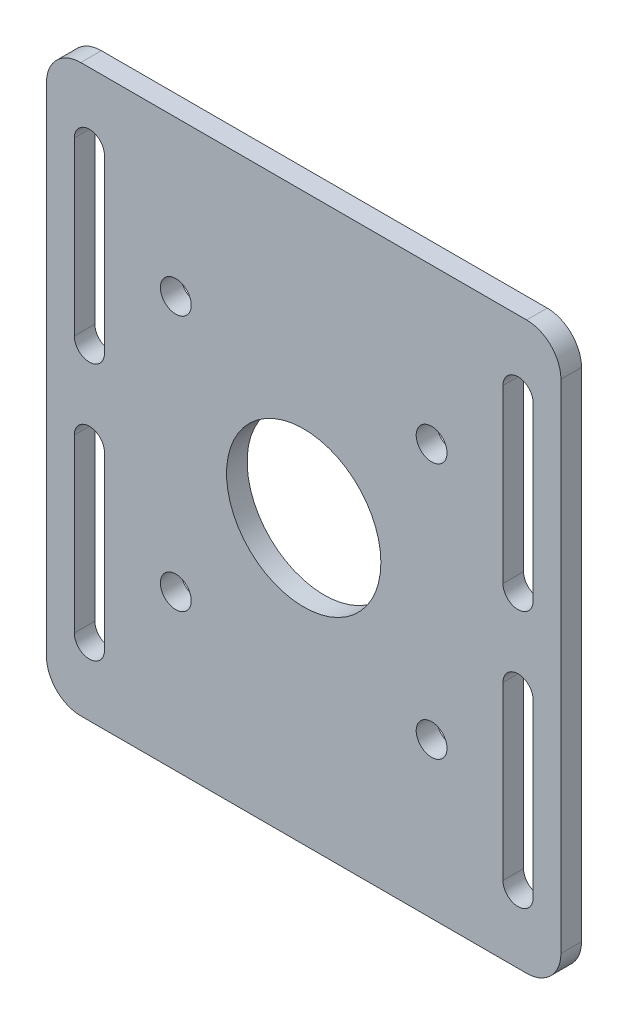
from build123d import *

# Parameters (mm, degrees)
SKETCH_1_W          = 300
SKETCH_1_H          = 330
SKETCH_1_R          = 45
EXTRUDE_1_DEPTH     = 6
CUT_EXTRUDE_1_DEPTH = 224.313680727
FILLET_1_R          = 20
SKETCH_3_R          = 9
CUT_EXTRUDE_2_DEPTH = 12


with BuildPart() as part:
    # Эскиз1 → Бобышка-Вытянуть1 (new, symmetric)
    with BuildSketch(Plane.XY):
        Rectangle(SKETCH_1_W, SKETCH_1_H)
        Circle(SKETCH_1_R, mode=Mode.SUBTRACT)
    extrude(amount=EXTRUDE_1_DEPTH, both=True)

    # Эскиз2 → Вырез-Вытянуть1 (cut, through all)
    with BuildSketch(Plane.XY.offset(6)):
        with BuildLine():
            Line((-116.2, 125), (-116.2, 25))
            ThreePointArc((-116.2, 25), (-125, 16.2), (-133.8, 25))
            Line((-133.8, 25), (-133.8, 125))
            ThreePointArc((-133.8, 125), (-125, 133.8), (-116.2, 125))
        make_face()
        with BuildLine():
            Line((-116.2, -125), (-116.2, -25))
            ThreePointArc((-116.2, -25), (-125, -16.2), (-133.8, -25))
            Line((-133.8, -25), (-133.8, -125))
            ThreePointArc((-133.8, -125), (-125, -133.8), (-116.2, -125))
        make_face()
        with BuildLine():
            Line((116.2, -125), (116.2, -25))
            ThreePointArc((116.2, -25), (125, -16.2), (133.8, -25))
            Line((133.8, -25), (133.8, -125))
            ThreePointArc((133.8, -125), (125, -133.8), (116.2, -125))
        make_face()
        with BuildLine():
            Line((116.2, 125), (116.2, 25))
            ThreePointArc((116.2, 25), (125, 16.2), (133.8, 25))
            Line((133.8, 25), (133.8, 125))
            ThreePointArc((133.8, 125), (125, 133.8), (116.2, 125))
        make_face()
    extrude(amount=-CUT_EXTRUDE_1_DEPTH, mode=Mode.SUBTRACT)

    # Скругление1
    fillet_1_edges = [part.edges().sort_by_distance(p)[0] for p in [
        (150, -165, 0),
        (-150, -165, 0),
        (-150, 165, 0),
        (150, 165, 0),
    ]]
    fillet(fillet_1_edges, radius=FILLET_1_R)

    # Эскиз3 → Вырез-Вытянуть2 (cut)
    with BuildSketch(Plane.XY.offset(6)):
        with Locations((-74.599765415, 74.599765415)):
            Circle(SKETCH_3_R)
        with Locations((74.599765415, 74.599765415)):
            Circle(SKETCH_3_R)
        with Locations((74.599765415, -74.599765415)):
            Circle(SKETCH_3_R)
        with Locations((-74.599765415, -74.599765415)):
            Circle(SKETCH_3_R)
    extrude(amount=-CUT_EXTRUDE_2_DEPTH, mode=Mode.SUBTRACT)


solid = part.part
